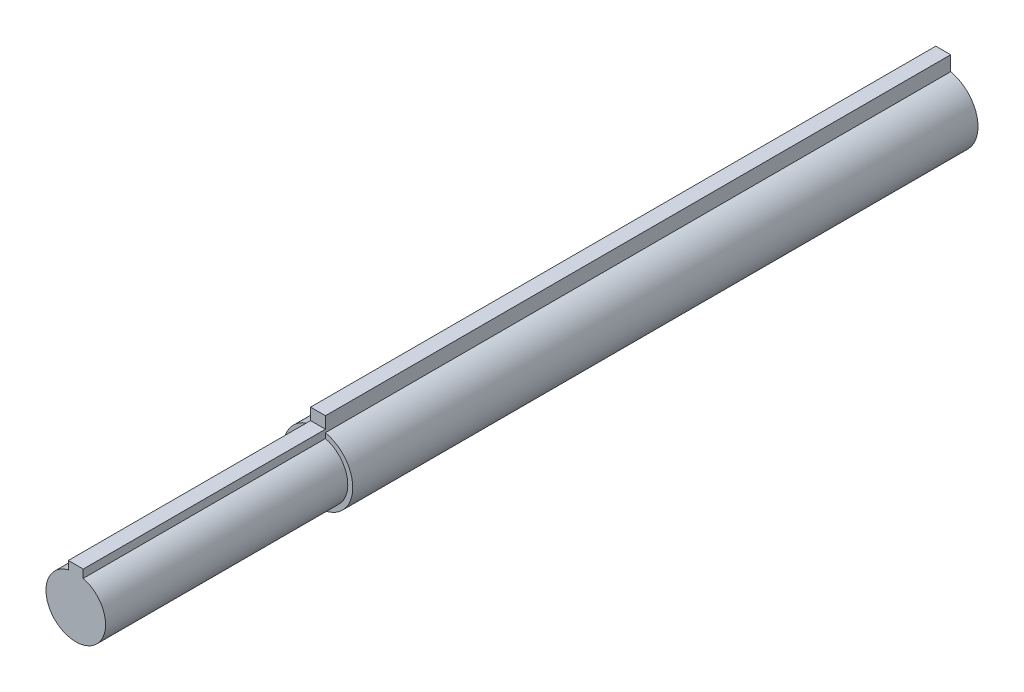
from build123d import *

# Parameters (mm, degrees)
BOSS_EXTRUDE1_DEPTH = 77.48
BOSS_EXTRUDE2_DEPTH = 200


with BuildPart() as part:
    # Sketch1 → Boss-Extrude1 (new body)
    with BuildSketch(Plane.XY):
        with BuildLine():
            Line((-2.38, 11.818027958), (2.38, 11.818027958))
            Line((2.38, 11.818027958), (2.38, 9.228027958))
            ThreePointArc((2.38, 9.228027958), (0, -9.53), (-2.38, 9.228027958))
            Line((-2.38, 9.228027958), (-2.38, 11.818027958))
        make_face()
    extrude(amount=BOSS_EXTRUDE1_DEPTH)

    # Sketch2 → Boss-Extrude2 (add)
    with BuildSketch(Plane(origin=(0, 0, 0), x_dir=(-1, 0, 0), z_dir=(0, 0, -1))):
        with BuildLine():
            Line((-2.38, 15.557201527), (2.38, 15.557201527))
            Line((2.38, 15.557201527), (2.38, 10.857201527))
            ThreePointArc((2.38, 10.857201527), (0, -11.115), (-2.38, 10.857201527))
            Line((-2.38, 10.857201527), (-2.38, 15.557201527))
        make_face()
    extrude(amount=BOSS_EXTRUDE2_DEPTH)


solid = part.part
